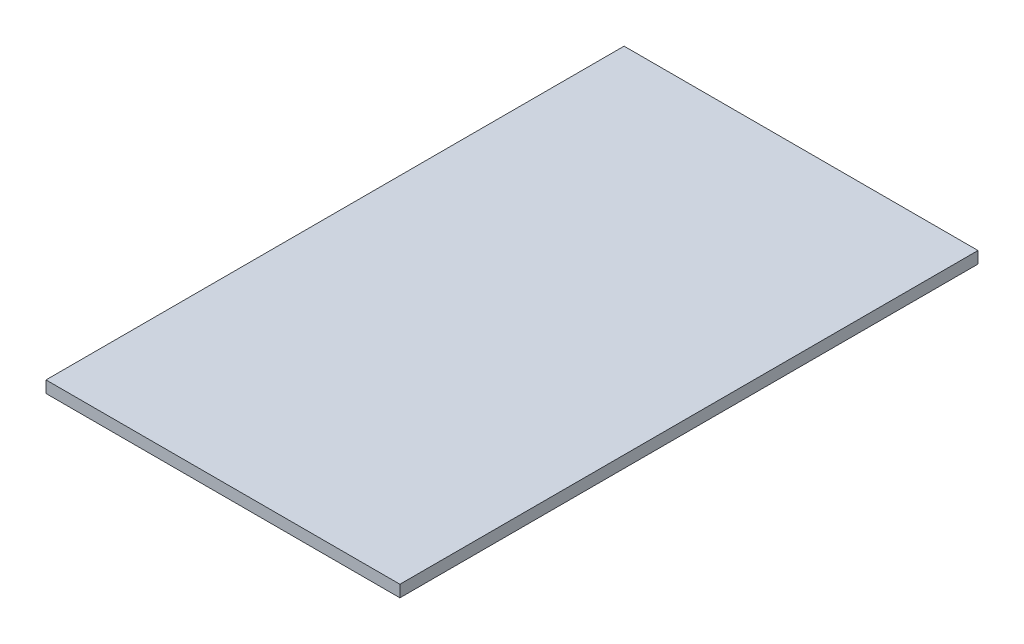
from build123d import *

# Parameters (mm, degrees)
SKETCH1_W           = 381
SKETCH1_H           = 622.3
BOSS_EXTRUDE1_DEPTH = 12.7


with BuildPart() as part:
    # Sketch1 → Boss-Extrude1 (new body)
    with BuildSketch(Plane(origin=(0, 0, 0), x_dir=(1, 0, 0), z_dir=(0, 1, 0))):
        with Locations((190.5, 311.15)):
            Rectangle(SKETCH1_W, SKETCH1_H)
    extrude(amount=BOSS_EXTRUDE1_DEPTH)


solid = part.part
